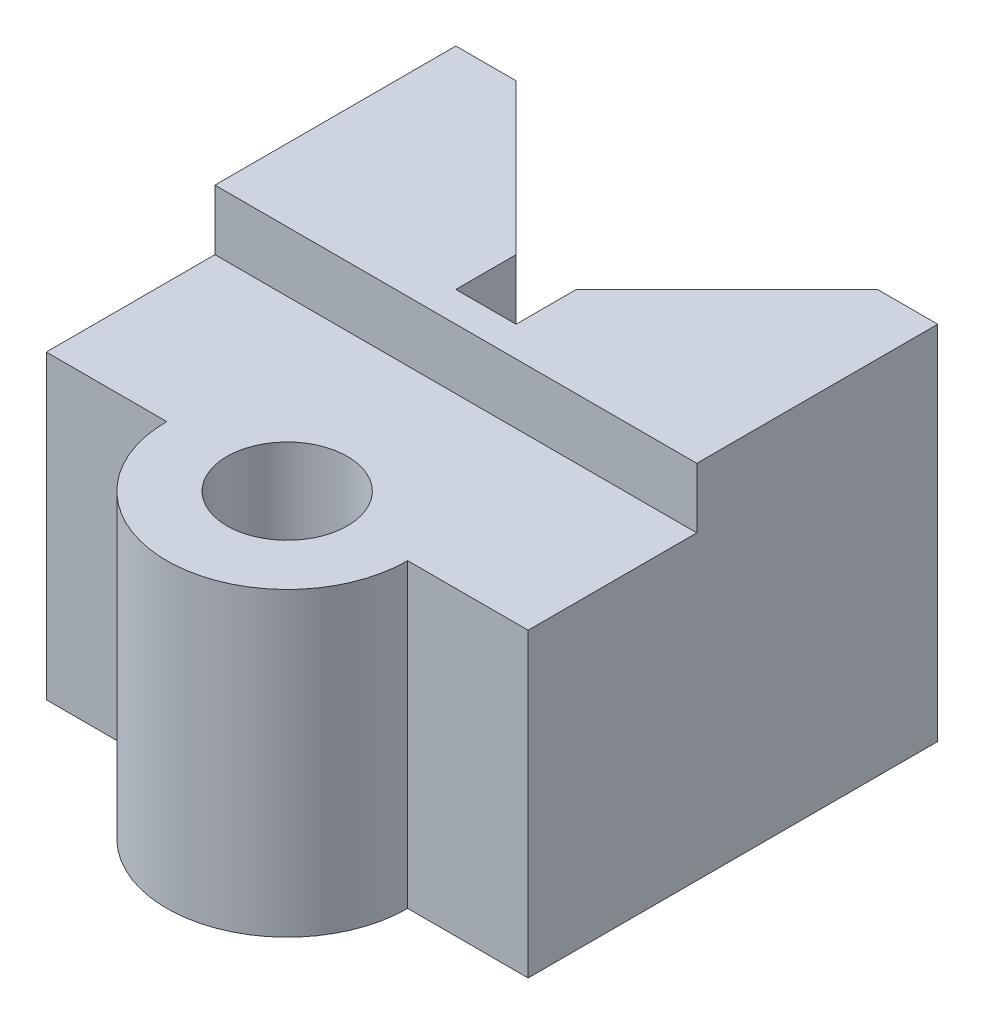
from build123d import *

# Parameters (mm, degrees)
EXTRUDE_319_DEPTH   = 30
EXTRUDE_1_DEPTH     = 30
SKETCH_3_R          = 5
CUT_EXTRUDE_1_DEPTH = 50.558046773
CUT_EXTRUDE_2_DEPTH = 5


with BuildPart() as part:
    # Эскиз1 → Extrude 319 (new body)
    with BuildSketch(Plane(origin=(0, 0, 0), x_dir=(1, 0, 0), z_dir=(0, 1, 0))):
        Polygon((20, 0), (-20, 0), (-20, 34), (-15, 34), (-2.5, 21.5), (-2.5, 16.5), (2.5, 16.5), (2.5, 21.5), (15, 34), (20, 34), align=None)
    extrude(amount=EXTRUDE_319_DEPTH)

    # Эскиз2 → Бобышка-Вытянуть1 (add)
    with BuildSketch(Plane(origin=(0, 30, 0), x_dir=(-1, 0, 0), z_dir=(0, 1, 0))):
        with BuildLine():
            Line((10, 0), (-10, 0))
            ThreePointArc((-10, 0), (0, 10), (10, 0))
        make_face()
    extrude(amount=-EXTRUDE_1_DEPTH)

    # Эскиз3 → Вырез-Вытянуть1 (cut, through all)
    with BuildSketch(Plane(origin=(0, 30, 0), x_dir=(-1, 0, 0), z_dir=(0, 1, 0))):
        with Locations(Location((0, 0, 0), (0, 0, 90))):
            Circle(SKETCH_3_R)
    extrude(amount=-CUT_EXTRUDE_1_DEPTH, mode=Mode.SUBTRACT)

    # Эскиз4 → Вырез-Вытянуть2 (cut)
    with BuildSketch(Plane(origin=(0, 30, 0), x_dir=(-1, 0, 0), z_dir=(0, 1, 0))):
        with BuildLine():
            Line((-10, 0), (-20, 0))
            Line((-20, 0), (-20, -14))
            Line((-20, -14), (20, -14))
            Line((20, -14), (20, 0))
            Line((20, 0), (10, 0))
            ThreePointArc((10, 0), (0, 10), (-10, 0))
        make_face()
    extrude(amount=-CUT_EXTRUDE_2_DEPTH, mode=Mode.SUBTRACT)


solid = part.part
